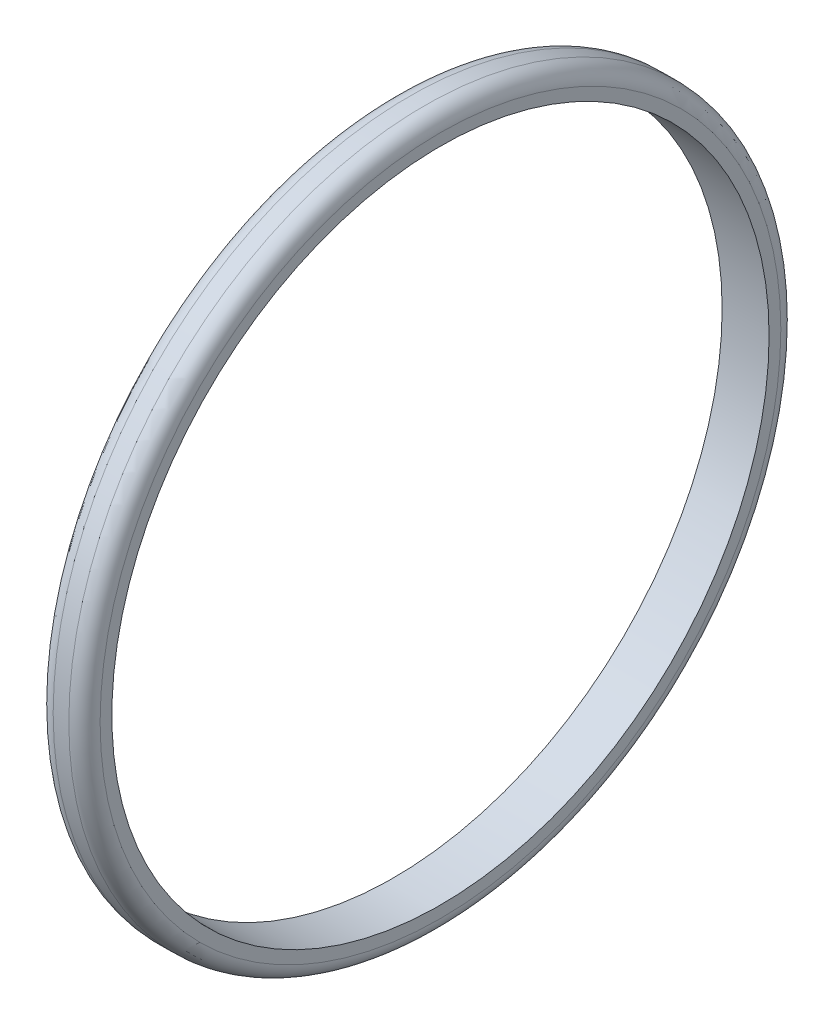
from build123d import *

# Parameters (mm, degrees)
SKETCH2_R           = 45.5
SKETCH2_R_2         = 42
BOSS_EXTRUDE1_DEPTH = 6
FILLET1_R           = 2


with BuildPart() as part:
    # Sketch2 → Boss-Extrude1 (new body)
    with BuildSketch(Plane(origin=(0, 0, 0), x_dir=(0, 0, -1), z_dir=(1, 0, 0))):
        Circle(SKETCH2_R)
        Circle(SKETCH2_R_2, mode=Mode.SUBTRACT)
    extrude(amount=BOSS_EXTRUDE1_DEPTH)

    # Fillet1
    fillet1_edges = [part.edges().sort_by_distance(p)[0] for p in [
        (0, 0, 45.5),
        (6, 0, 45.5),
    ]]
    fillet(fillet1_edges, radius=FILLET1_R)


solid = part.part
